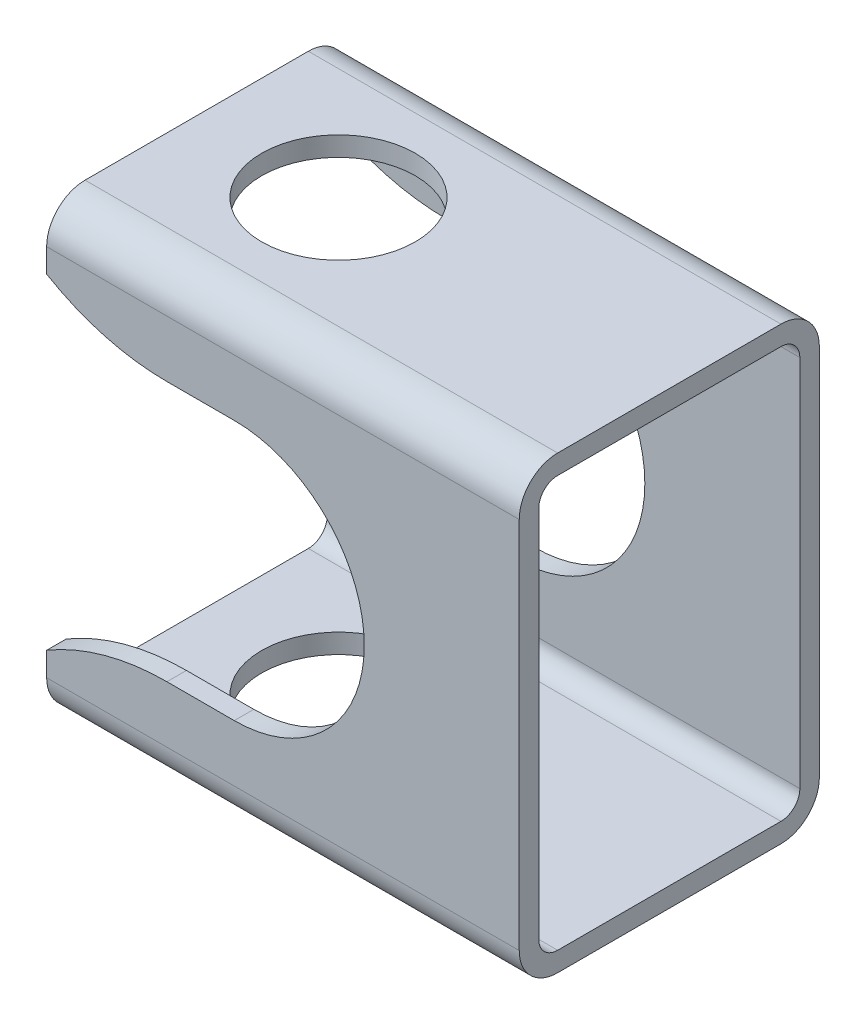
from build123d import *

# Parameters (mm, degrees)
FSAE_CHASSIS_1_5_X_1_INCH_RECT_1_DEPTH = 40
CUT_EXTRUDE1_DEPTH                     = 52.069193258
CUT_EXTRUDE1_DEPTH_BACK                = 52.069193258
F_13_0_13_DIAMETER_HOLE2_D             = 13


with BuildPart() as part:
    # Sketch15 → Fsae chassis 1_5 X 1 INCH RECT(1) (new body)
    with BuildSketch(Plane(origin=(0, 0, 0), x_dir=(0, 0, -1), z_dir=(1, 0, 0))):
        with BuildLine():
            Line((-9.4488, 19.05), (9.4488, 19.05))
            ThreePointArc((9.4488, 19.05), (11.747745567, 18.097745567), (12.7, 15.7988))
            Line((12.7, 15.7988), (12.7, -15.7988))
            ThreePointArc((12.7, -15.7988), (11.747745567, -18.097745567), (9.4488, -19.05))
            Line((9.4488, -19.05), (-9.4488, -19.05))
            ThreePointArc((-9.4488, -19.05), (-11.747745567, -18.097745567), (-12.7, -15.7988))
            Line((-12.7, -15.7988), (-12.7, 15.7988))
            ThreePointArc((-12.7, 15.7988), (-11.747745567, 18.097745567), (-9.4488, 19.05))
        make_face()
        with BuildLine():
            Line((-9.4488, -17.399), (9.4488, -17.399))
            ThreePointArc((9.4488, -17.399), (10.580312271, -16.930312271), (11.049, -15.7988))
            Line((11.049, -15.7988), (11.049, 15.7988))
            ThreePointArc((11.049, 15.7988), (10.580312271, 16.930312271), (9.4488, 17.399))
            Line((9.4488, 17.399), (-9.4488, 17.399))
            ThreePointArc((-9.4488, 17.399), (-10.580312271, 16.930312271), (-11.049, 15.7988))
            Line((-11.049, 15.7988), (-11.049, -15.7988))
            ThreePointArc((-11.049, -15.7988), (-10.580312271, -16.930312271), (-9.4488, -17.399))
        make_face(mode=Mode.SUBTRACT)
    extrude(amount=FSAE_CHASSIS_1_5_X_1_INCH_RECT_1_DEPTH)

    # Sketch16 → Cut-Extrude1 (cut, two sides: drawn at the far end of the back side and taken through both)
    with BuildSketch(Plane(origin=(0, 0, -12.7), x_dir=(-1, 0, 0), z_dir=(0, 0, -1)).offset(-CUT_EXTRUDE1_DEPTH_BACK)):
        with BuildLine():
            Line((-15.88, 11), (-10.18, 11))
            ThreePointArc((-10.18, 11), (-4.903003105, 11.708724672), (0, 13.784669623))
            Line((0, 13.784669623), (0, -13.784669623))
            ThreePointArc((0, -13.784669623), (-4.903003105, -11.708724672), (-10.18, -11))
            Line((-10.18, -11), (-15.88, -11))
            ThreePointArc((-15.88, -11), (-26.88, 0), (-15.88, 11))
        make_face()
    extrude(amount=CUT_EXTRUDE1_DEPTH + CUT_EXTRUDE1_DEPTH_BACK, mode=Mode.SUBTRACT)

    # Ø13.0 (13) Diameter Hole2 (through all)
    with Locations(Plane(origin=(0, 19.05, 0), x_dir=(1, 0, 0), z_dir=(0, 1, 0))):
        with Locations((12, 0)):
            Hole(F_13_0_13_DIAMETER_HOLE2_D / 2)


solid = part.part
